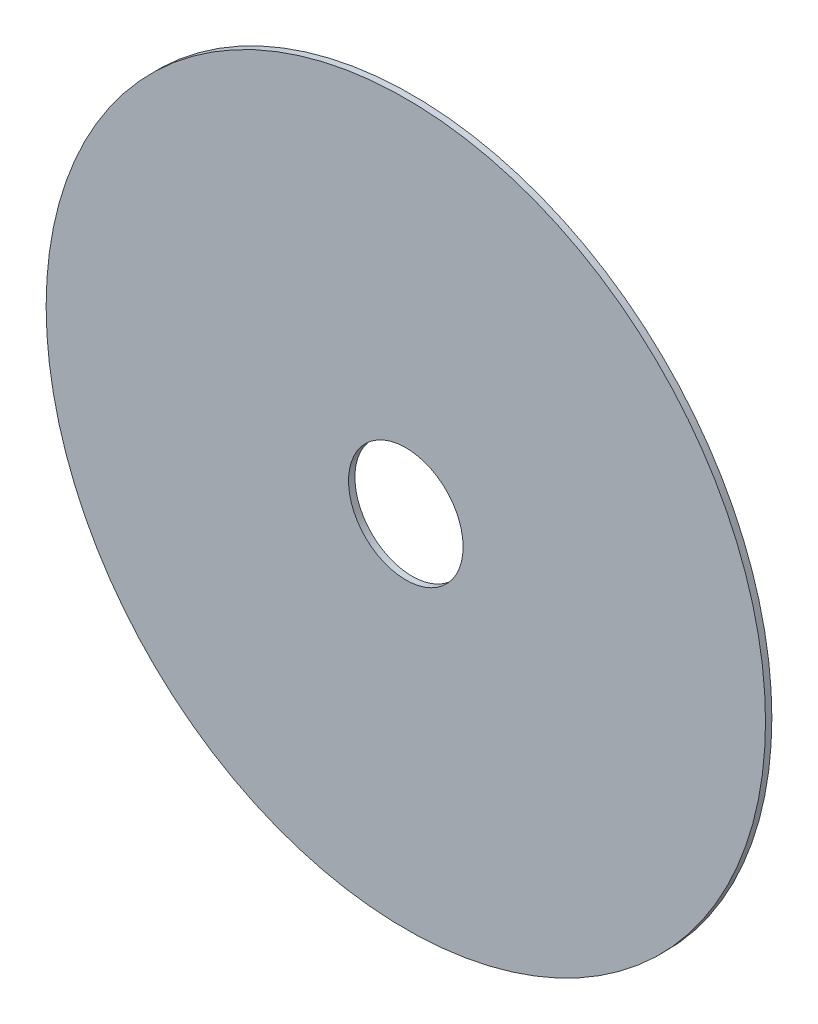
from build123d import *

# Parameters (mm, degrees)
SKETCH1_R           = 282.5
SKETCH1_R_2         = 45
BOSS_EXTRUDE1_DEPTH = 5


with BuildPart() as part:
    # Sketch1 → Boss-Extrude1 (new body)
    with BuildSketch(Plane.XY):
        Circle(SKETCH1_R)
        Circle(SKETCH1_R_2, mode=Mode.SUBTRACT)
    extrude(amount=BOSS_EXTRUDE1_DEPTH)


solid = part.part
